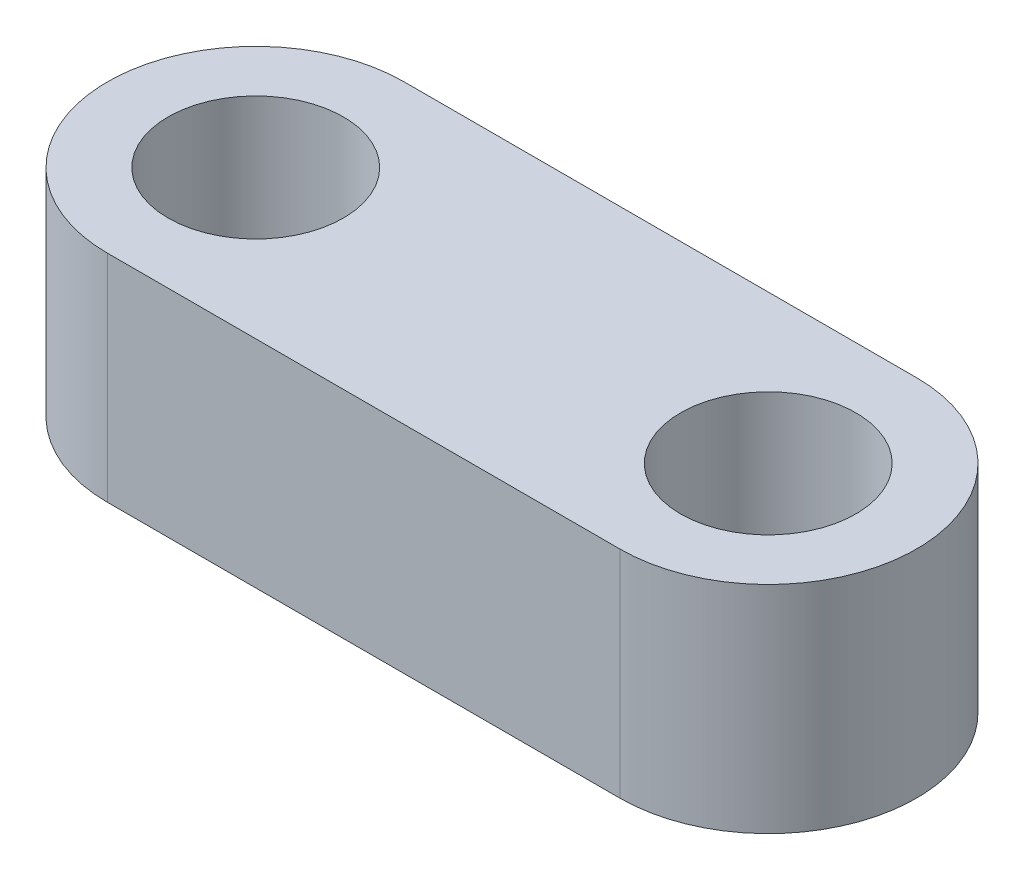
from build123d import *

# Parameters (mm, degrees)
SKETCH1_R           = 1.625
BOSS_EXTRUDE1_DEPTH = 4


with BuildPart() as part:
    # Sketch1 → Boss-Extrude1 (new body)
    with BuildSketch(Plane(origin=(0, 0, 0), x_dir=(1, 0, 0), z_dir=(0, 1, 0))):
        with BuildLine():
            Line((0, 2.75), (9.5, 2.75))
            ThreePointArc((9.5, 2.75), (12.25, 0), (9.5, -2.75))
            Line((9.5, -2.75), (0, -2.75))
            ThreePointArc((0, -2.75), (-2.75, 0), (0, 2.75))
        make_face()
        with Locations(Location((0, 0, 0), (0, 0, 270))):
            Circle(SKETCH1_R, mode=Mode.SUBTRACT)
        with Locations(Location((9.5, 0, 0), (0, 0, 270))):
            Circle(SKETCH1_R, mode=Mode.SUBTRACT)
    extrude(amount=BOSS_EXTRUDE1_DEPTH)


solid = part.part
